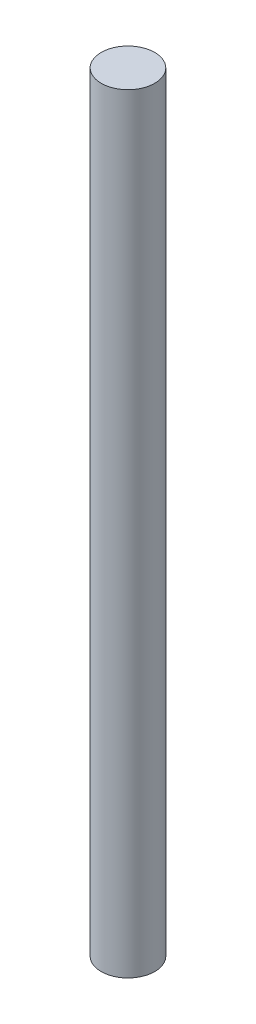
from build123d import *

# Parameters (mm, degrees)
SKETCH1_R           = 4
BOSS_EXTRUDE1_DEPTH = 115


with BuildPart() as part:
    # Sketch1 → Boss-Extrude1 (new body)
    with BuildSketch(Plane(origin=(0, 0, 0), x_dir=(1, 0, 0), z_dir=(0, 1, 0))):
        with Locations(Location((0, 0, 0), (0, 0, 270))):
            Circle(SKETCH1_R)
    extrude(amount=BOSS_EXTRUDE1_DEPTH)


solid = part.part
